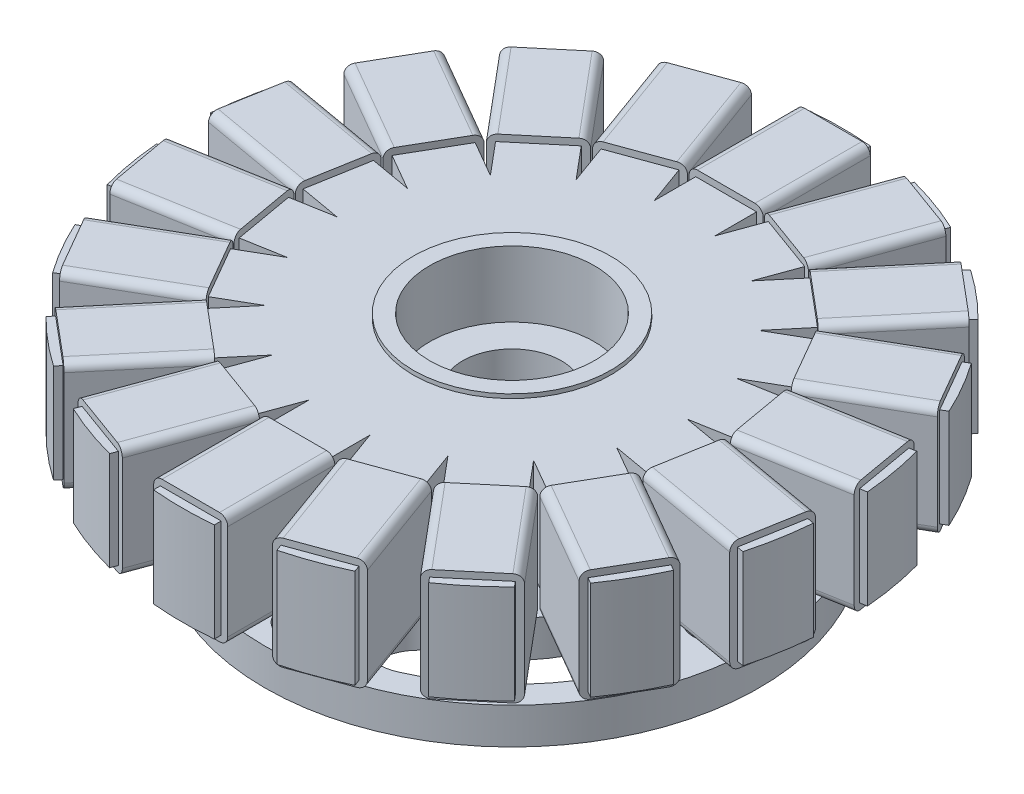
from build123d import *

# Parameters (mm, degrees)
SKETCH1_R                = 15
SKETCH1_R_2              = 1.5
BOSS_EXTRUDE1_DEPTH      = 2.2
SKETCH2_R                = 6
BOSS_EXTRUDE2_DEPTH      = 10
SKETCH3_R                = 5
CUT_EXTRUDE1_DEPTH       = 4
CUT_EXTRUDE2_START       = -4
SKETCH4_R                = 5
CUT_EXTRUDE2_DEPTH       = 4
SKETCH5_R                = 3
CUT_EXTRUDE3_DEPTH       = 10
CUT_EXTRUDE4_DEPTH       = 2.2
CIRPATTERN1_COUNT        = 4
BOSS_EXTRUDE3_START      = -6
BOSS_EXTRUDE3_DEPTH      = 6
CIRPATTERN2_COUNT        = 18
SKETCH9_W                = 4.492524378
SKETCH9_H                = 6.8
SKETCH9_W_2              = 3.692524378
SKETCH9_H_2              = 6
BOSS_EXTRUDE4_DEPTH      = 6.5
FILLET1_R                = 0.5
CIRPATTERN5_COUNT        = 18
FILLET1_OF_CIRPATTERN5_R = 0.5


with BuildPart() as part:
    # Sketch1 → Boss-Extrude1 (new body)
    with BuildSketch(Plane(origin=(0, 0, 0), x_dir=(1, 0, 0), z_dir=(0, 1, 0))):
        with Locations(Location((0, 0, 0), (0, 0, 270))):
            Circle(SKETCH1_R)
        with Locations(Location((0, 12.5, 0), (0, 0, 270))):
            Circle(SKETCH1_R_2, mode=Mode.SUBTRACT)
        with Locations(Location((12.5, 0, 0), (0, 0, 270))):
            Circle(SKETCH1_R_2, mode=Mode.SUBTRACT)
        with Locations(Location((0, -12.5, 0), (0, 0, 270))):
            Circle(SKETCH1_R_2, mode=Mode.SUBTRACT)
        with Locations(Location((-12.5, 0, 0), (0, 0, 270))):
            Circle(SKETCH1_R_2, mode=Mode.SUBTRACT)
    extrude(amount=BOSS_EXTRUDE1_DEPTH)

    # Sketch2 → Boss-Extrude2 (add)
    with BuildSketch(Plane(origin=(0, 2.2, 0), x_dir=(1, 0, 0), z_dir=(0, 1, 0))):
        with Locations(Location((0, 0, 0), (0, 0, 270))):
            Circle(SKETCH2_R)
    extrude(amount=BOSS_EXTRUDE2_DEPTH)

    # Sketch3 → Cut-Extrude1 (cut)
    with BuildSketch(Plane.XZ):
        with Locations(Location((0, 0, 0), (0, 0, 270))):
            Circle(SKETCH3_R)
    extrude(amount=-CUT_EXTRUDE1_DEPTH, mode=Mode.SUBTRACT)

    # Sketch4 → Cut-Extrude2 (cut)
    with BuildSketch(Plane(origin=(0, 12.2, 0), x_dir=(1, 0, 0), z_dir=(0, 1, 0)).offset(CUT_EXTRUDE2_START)):
        with Locations(Location((0, 0, 0), (0, 0, 90))):
            Circle(SKETCH4_R)
    extrude(amount=CUT_EXTRUDE2_DEPTH, mode=Mode.SUBTRACT)

    # Sketch5 → Cut-Extrude3 (cut)
    with BuildSketch(Plane(origin=(0, 8.2, 0), x_dir=(1, 0, 0), z_dir=(0, 1, 0))):
        with Locations(Location((0, 0, 0), (0, 0, 270))):
            Circle(SKETCH5_R)
    extrude(amount=-CUT_EXTRUDE3_DEPTH, mode=Mode.SUBTRACT)

    # Sketch6 → Cut-Extrude4 (cut)
    with BuildSketch(Plane.XZ):
        with BuildLine():
            ThreePointArc((-5.400804504, 12.317208627), (-9.510055669, 9.510055669), (-12.317208627, 5.400804504))
            ThreePointArc((-12.317208627, 5.400804504), (-11.057658754, 2.174168119), (-7.831022368, 3.433717992))
            ThreePointArc((-7.831022368, 3.433717992), (-6.046293517, 6.046293517), (-3.433717992, 7.831022368))
            ThreePointArc((-3.433717992, 7.831022368), (-2.174168119, 11.057658754), (-5.400804504, 12.317208627))
        make_face()
    cut_extrude4 = extrude(amount=-CUT_EXTRUDE4_DEPTH, mode=Mode.SUBTRACT)

    # CirPattern1: Cut-Extrude4 ×4 about axis
    cirpattern1_axis = Axis((0, 0, 0), (0, 1, 0))
    for i in range(1, CIRPATTERN1_COUNT):
        add(cut_extrude4.rotate(cirpattern1_axis, i * 360 / CIRPATTERN1_COUNT), mode=Mode.SUBTRACT)

    # Sketch7 → Boss-Extrude3 (add)
    with BuildSketch(Plane(origin=(0, 11.95, 0), x_dir=(1, 0, 0), z_dir=(0, 1, 0)).offset(BOSS_EXTRUDE3_START)):
        with BuildLine():
            Line((-19.291452977, -5.276347416), (-9.991000066, -3.636426635))
            Line((-9.991000066, -3.636426635), (-5.638155725, -2.05212086))
            ThreePointArc((-5.638155725, -2.05212086), (-5.908846518, -1.041889066), (-6, 0))
            Line((-6, 0), (-10.632200195, 0))
            Line((-10.632200195, 0), (-19.932653106, -1.639920781))
            ThreePointArc((-19.932653106, -1.639920781), (-19.69615506, -3.472963553), (-19.291452977, -5.276347416))
        make_face()
    boss_extrude3 = extrude(amount=BOSS_EXTRUDE3_DEPTH)

    # CirPattern2: Boss-Extrude3 ×18 about axis
    cirpattern2_axis = Axis((0, 0, 0), (0, 1, 0))
    for i in range(1, CIRPATTERN2_COUNT):
        add(boss_extrude3.rotate(cirpattern2_axis, i * 360 / CIRPATTERN2_COUNT))

    # Sketch9 → Boss-Extrude4 (add)
    with BuildSketch(Plane.XY.offset(13)):
        with Locations((0, 8.95)):
            Rectangle(SKETCH9_W, SKETCH9_H)
        with Locations((0, 8.95)):
            Rectangle(SKETCH9_W_2, SKETCH9_H_2, mode=Mode.SUBTRACT)
    boss_extrude4 = extrude(amount=BOSS_EXTRUDE4_DEPTH)

    # Fillet1
    fillet1_edges = [part.edges().sort_by_distance(p)[0] for p in [
        (-2.246262189, 12.35, 16.25),
        (-2.246262189, 5.55, 16.25),
        (2.246262189, 5.55, 16.25),
        (2.246262189, 12.35, 16.25),
    ]]
    fillet(fillet1_edges, radius=FILLET1_R)

    # CirPattern5: Boss-Extrude4 ×18 about axis
    cirpattern5_axis = Axis((0, 0, 0), (0, 1, 0))
    for i in range(1, CIRPATTERN5_COUNT):
        add(boss_extrude4.rotate(cirpattern5_axis, i * 360 / CIRPATTERN5_COUNT))

    # Fillet1 of CirPattern5
    fillet1_of_cirpattern5_edges = [part.edges().sort_by_distance(p)[0] for p in [
        (3.447031326, 12.35, 16.038272003),
        (3.447031326, 5.55, 16.038272003),
        (7.668623332, 5.55, 14.501738172),
        (7.668623332, 12.35, 14.501738172),
        (8.72456199, 12.35, 13.892091704),
        (8.72456199, 5.55, 13.892091704),
        (12.166035325, 5.55, 11.004352698),
        (12.166035325, 12.35, 11.004352698),
        (12.949781717, 12.35, 10.070320119),
        (12.949781717, 5.55, 10.070320119),
        (15.196043906, 5.55, 6.179679881),
        (15.196043906, 12.35, 6.179679881),
        (15.613066651, 12.35, 5.033919306),
        (15.613066651, 5.55, 5.033919306),
        (16.393185322, 5.55, 0.609646469),
        (16.393185322, 12.35, 0.609646469),
        (16.393185322, 12.35, -0.609646469),
        (16.393185322, 5.55, -0.609646469),
        (15.613066651, 5.55, -5.033919306),
        (15.613066651, 12.35, -5.033919306),
        (15.196043906, 12.35, -6.179679881),
        (15.196043906, 5.55, -6.179679881),
        (12.949781717, 5.55, -10.070320119),
        (12.949781717, 12.35, -10.070320119),
        (12.166035325, 12.35, -11.004352698),
        (12.166035325, 5.55, -11.004352698),
        (8.72456199, 5.55, -13.892091704),
        (8.72456199, 12.35, -13.892091704),
        (7.668623332, 12.35, -14.501738172),
        (7.668623332, 5.55, -14.501738172),
        (3.447031326, 5.55, -16.038272003),
        (3.447031326, 12.35, -16.038272003),
        (2.246262189, 12.35, -16.25),
        (2.246262189, 5.55, -16.25),
        (-2.246262189, 5.55, -16.25),
        (-2.246262189, 12.35, -16.25),
        (-3.447031326, 12.35, -16.038272003),
        (-3.447031326, 5.55, -16.038272003),
        (-7.668623332, 5.55, -14.501738172),
        (-7.668623332, 12.35, -14.501738172),
        (-8.72456199, 12.35, -13.892091704),
        (-8.72456199, 5.55, -13.892091704),
        (-12.166035325, 5.55, -11.004352698),
        (-12.166035325, 12.35, -11.004352698),
        (-12.949781717, 12.35, -10.070320119),
        (-12.949781717, 5.55, -10.070320119),
        (-15.196043906, 5.55, -6.179679881),
        (-15.196043906, 12.35, -6.179679881),
        (-15.613066651, 12.35, -5.033919306),
        (-15.613066651, 5.55, -5.033919306),
        (-16.393185322, 5.55, -0.609646469),
        (-16.393185322, 12.35, -0.609646469),
        (-16.393185322, 12.35, 0.609646469),
        (-16.393185322, 5.55, 0.609646469),
        (-15.613066651, 5.55, 5.033919306),
        (-15.613066651, 12.35, 5.033919306),
        (-15.196043906, 12.35, 6.179679881),
        (-15.196043906, 5.55, 6.179679881),
        (-12.949781717, 5.55, 10.070320119),
        (-12.949781717, 12.35, 10.070320119),
        (-12.166035325, 12.35, 11.004352698),
        (-12.166035325, 5.55, 11.004352698),
        (-8.72456199, 5.55, 13.892091704),
        (-8.72456199, 12.35, 13.892091704),
        (-7.668623332, 12.35, 14.501738172),
        (-7.668623332, 5.55, 14.501738172),
        (-3.447031326, 5.55, 16.038272003),
        (-3.447031326, 12.35, 16.038272003),
    ]]
    fillet(fillet1_of_cirpattern5_edges, radius=FILLET1_OF_CIRPATTERN5_R)


solid = part.part
